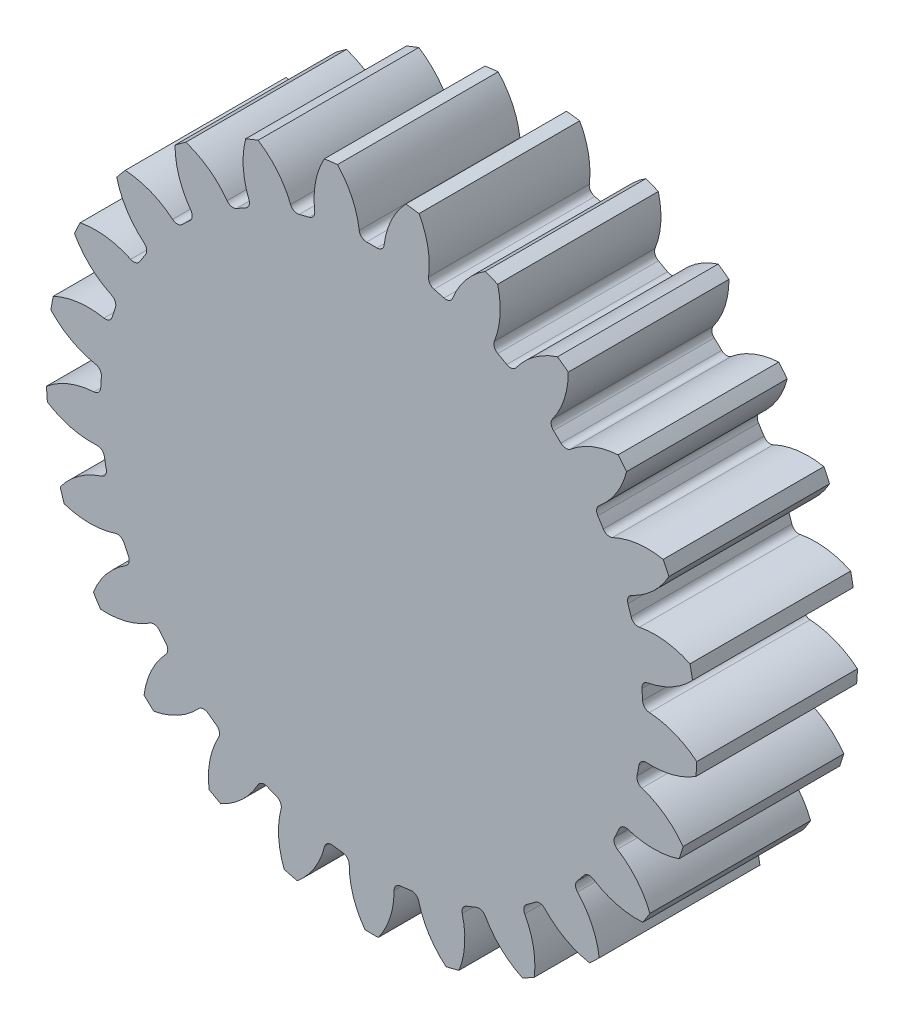
from build123d import *

# Parameters (mm, degrees)
SKETCH1_R                = 40.5
BOSS_EXTRUDE1_DEPTH      = 10
CUT_EXTRUDE1_DEPTH       = 59.142067387
FILLET1_R                = 0.9
CIRPATTERN1_COUNT        = 25
FILLET1_OF_CIRPATTERN1_R = 0.9


with BuildPart() as part:
    # Sketch1 → Boss-Extrude1 (new, symmetric)
    with BuildSketch(Plane.XY):
        Circle(SKETCH1_R)
    extrude(amount=BOSS_EXTRUDE1_DEPTH, both=True)

    # Sketch2 → Cut-Extrude1 (cut, symmetric)
    with BuildSketch(Plane.XY):
        with BuildLine():
            ThreePointArc((-5.210338616, 41.171620948), (-2.551204058, 37.84201841), (-1.480899222, 33.717494532))
            ThreePointArc((-1.480899222, 33.717494532), (0, 33.75), (1.480899222, 33.717494532))
            ThreePointArc((1.480899222, 33.717494532), (2.551204058, 37.84201841), (5.210338616, 41.171620948))
            ThreePointArc((5.210338616, 41.171620948), (0, 41.5), (-5.210338616, 41.171620948))
        make_face()
    cut_extrude1 = extrude(amount=CUT_EXTRUDE1_DEPTH, both=True, mode=Mode.SUBTRACT)

    # Fillet1
    fillet1_edges = [part.edges().sort_by_distance(p)[0] for p in [
        (-1.480899222, 33.717494532, 0),
        (1.480899222, 33.717494532, 0),
    ]]
    fillet(fillet1_edges, radius=FILLET1_R)

    # CirPattern1: Cut-Extrude1 ×25 about axis
    cirpattern1_axis = Axis((0, 0, 0), (0, 0, 1))
    for i in range(1, CIRPATTERN1_COUNT):
        add(cut_extrude1.rotate(cirpattern1_axis, i * 360 / CIRPATTERN1_COUNT), mode=Mode.SUBTRACT)

    # Fillet1 of CirPattern1
    fillet1_of_cirpattern1_edges = [part.edges().sort_by_distance(p)[0] for p in [
        (-9.81957396, 32.289912779, 0),
        (-6.950825861, 33.026482099, 0),
        (-17.541248752, 28.833437052, 0),
        (-14.945804992, 30.260294333, 0),
        (-24.160742374, 23.565250433, 0),
        (-22.001684228, 25.592740985, 0),
        (-29.262127695, 16.816372462, 0),
        (-27.675116727, 19.317101597, 0),
        (-32.524865914, 9.010859963, 0),
        (-31.609619861, 11.827697673, 0),
        (-33.74394719, 0.639161994, 0),
        (-33.557974327, 3.595116004, 0),
        (-32.842772162, -7.772696875, 0),
        (-33.397757848, -4.863360025, 0),
        (-29.877964972, -15.696168613, 0),
        (-31.139037415, -13.016253257, 0),
        (-25.03581536, -22.63339235, 0),
        (-26.92373674, -20.351287427, 0),
        (-18.620573393, -28.148476806, 0),
        (-21.016718667, -26.407575361, 0),
        (-11.035332318, -31.894888942, 0),
        (-13.789142866, -30.804578215, 0),
        (-2.756700728, -33.637227904, 0),
        (-5.695144506, -33.266016128, 0),
        (5.695144506, -33.266016128, 0),
        (2.756700728, -33.637227904, 0),
        (13.789142866, -30.804578215, 0),
        (11.035332318, -31.894888942, 0),
        (21.016718667, -26.407575361, 0),
        (18.620573393, -28.148476806, 0),
        (26.92373674, -20.351287427, 0),
        (25.03581536, -22.63339235, 0),
        (31.139037415, -13.016253257, 0),
        (29.877964972, -15.696168613, 0),
        (33.397757848, -4.863360025, 0),
        (32.842772162, -7.772696875, 0),
        (33.557974327, 3.595116004, 0),
        (33.74394719, 0.639161994, 0),
        (31.609619861, 11.827697673, 0),
        (32.524865914, 9.010859963, 0),
        (27.675116727, 19.317101597, 0),
        (29.262127695, 16.816372462, 0),
        (22.001684228, 25.592740985, 0),
        (24.160742374, 23.565250433, 0),
        (14.945804992, 30.260294333, 0),
        (17.541248752, 28.833437052, 0),
        (6.950825861, 33.026482099, 0),
        (9.81957396, 32.289912779, 0),
    ]]
    fillet(fillet1_of_cirpattern1_edges, radius=FILLET1_OF_CIRPATTERN1_R)


solid = part.part
